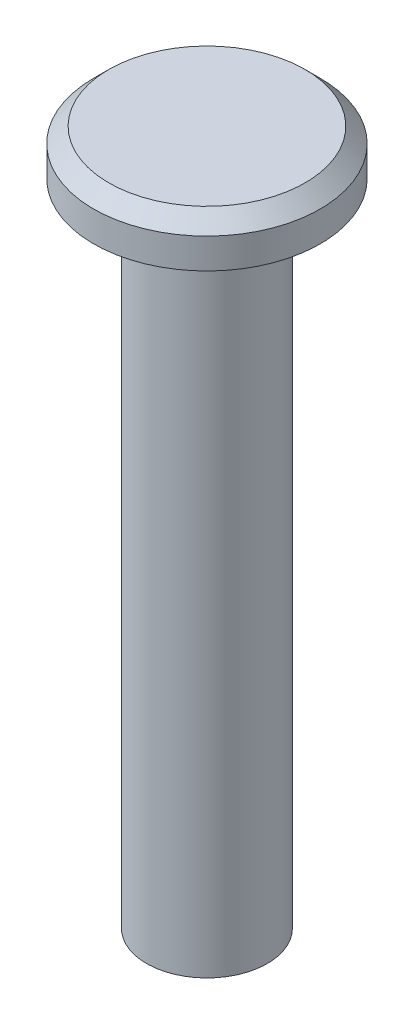
from build123d import *


with BuildPart() as part:
    # Sketch1 → Revolve1 (revolve)
    with BuildSketch(Plane.XY, mode=Mode.PRIVATE) as revolve1_sk:
        Polygon((0, 0), (4, 0), (4, 43), (7.5, 43), (7.5, 45), (6.5, 46), (0, 46), align=None)
    revolve(revolve1_sk.sketch.rotate(Axis((0, 33.604972013, 0), (0, -1, 0)), 180), axis=Axis((0, 33.604972013, 0), (0, -1, 0)))


solid = part.part
